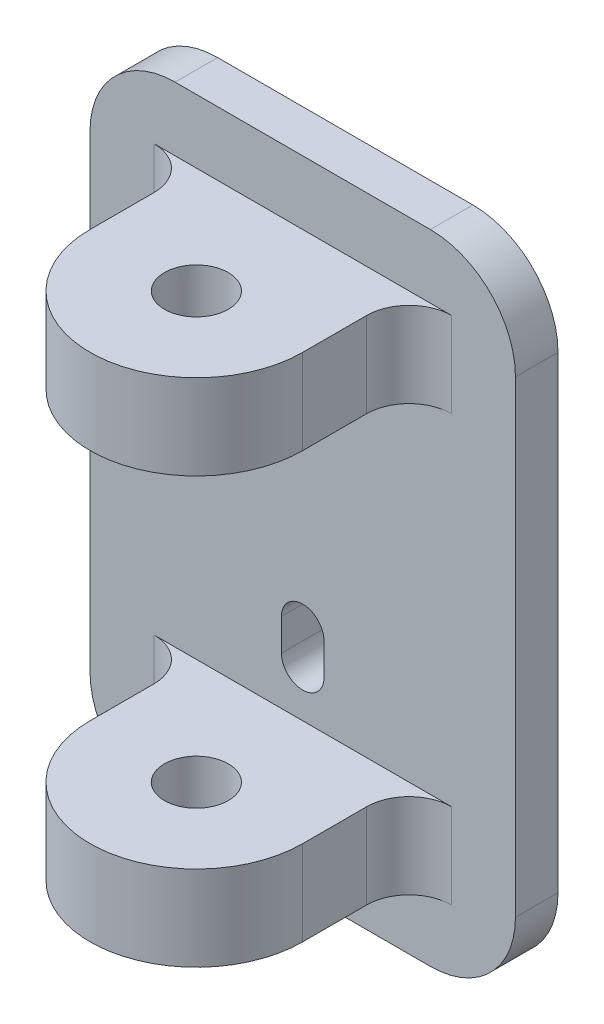
from build123d import *

# Parameters (mm, degrees)
BOSS_EXTRUDE1_DEPTH = 2.54
SKETCH2_W           = 12.7
SKETCH2_H           = 5.08
BOSS_EXTRUDE2_DEPTH = 12.7
CUT_EXTRUDE2_DEPTH  = 101.731669178
SKETCH4_R           = 1.905
CUT_EXTRUDE3_DEPTH  = 101.731669178
SKETCH5_R           = 1.27
CUT_EXTRUDE4_DEPTH  = 105.216075999
FILLET2_R           = 2.54


with BuildPart() as part:
    # Sketch1 → Boss-Extrude1 (new body)
    with BuildSketch(Plane.XY):
        with BuildLine():
            Line((73.161588965, -6.18197174), (88.401588965, -6.18197174))
            ThreePointArc((88.401588965, -6.18197174), (91.993691413, -7.669869292), (93.481588965, -11.26197174))
            Line((93.481588965, -11.26197174), (93.481588965, -39.20197174))
            ThreePointArc((93.481588965, -39.20197174), (91.993691413, -42.794074189), (88.401588965, -44.28197174))
            Line((88.401588965, -44.28197174), (73.161588965, -44.28197174))
            ThreePointArc((73.161588965, -44.28197174), (69.569486517, -42.794074189), (68.081588965, -39.20197174))
            Line((68.081588965, -39.20197174), (68.081588965, -11.26197174))
            ThreePointArc((68.081588965, -11.26197174), (69.569486517, -7.669869292), (73.161588965, -6.18197174))
        make_face()
    extrude(amount=BOSS_EXTRUDE1_DEPTH)

    # Sketch2 → Boss-Extrude2 (add)
    with BuildSketch(Plane.XY.offset(2.54)):
        with Locations((80.781588965, -12.53197174)):
            Rectangle(SKETCH2_W, SKETCH2_H)
        with Locations((80.781588965, -37.93197174)):
            Rectangle(SKETCH2_W, SKETCH2_H)
    extrude(amount=BOSS_EXTRUDE2_DEPTH)

    # Sketch3 → Cut-Extrude2 (cut, through all)
    with BuildSketch(Plane(origin=(0, -40.47197174, 0), x_dir=(-1, 0, 0), z_dir=(0, -1, 0))):
        with BuildLine():
            Line((-87.131588965, -15.24), (-80.781588965, -15.24))
            ThreePointArc((-80.781588965, -15.24), (-85.271717026, -13.380128061), (-87.131588965, -8.89))
            Line((-87.131588965, -8.89), (-87.131588965, -15.24))
        make_face()
        with BuildLine():
            Line((-74.431588965, -15.24), (-74.431588965, -8.89))
            ThreePointArc((-74.431588965, -8.89), (-76.291460904, -13.380128061), (-80.781588965, -15.24))
            Line((-80.781588965, -15.24), (-74.431588965, -15.24))
        make_face()
    extrude(amount=-CUT_EXTRUDE2_DEPTH, mode=Mode.SUBTRACT)

    # Sketch4 → Cut-Extrude3 (cut, through all)
    with BuildSketch(Plane.XZ.offset(40.47197174)):
        with Locations((80.781588965, 8.89)):
            Circle(SKETCH4_R)
    extrude(amount=-CUT_EXTRUDE3_DEPTH, mode=Mode.SUBTRACT)

    # Sketch5 → Cut-Extrude4 (cut, through all)
    with BuildSketch(Plane.XY.offset(2.54)):
        with Locations((80.781588965, -18.88197174)):
            Circle(SKETCH5_R)
        with BuildLine():
            Line((79.511588965, -32.53447174), (79.511588965, -30.62947174))
            ThreePointArc((79.511588965, -30.62947174), (80.781588965, -29.35947174), (82.051588965, -30.62947174))
            Line((82.051588965, -30.62947174), (82.051588965, -32.53447174))
            ThreePointArc((82.051588965, -32.53447174), (80.781588965, -33.80447174), (79.511588965, -32.53447174))
        make_face()
    extrude(amount=-CUT_EXTRUDE4_DEPTH, mode=Mode.SUBTRACT)

    # Fillet2
    fillet2_edges = [part.edges().sort_by_distance(p)[0] for p in [
        (87.131588965, -12.53197174, 2.54),
        (87.131588965, -37.93197174, 2.54),
        (74.431588965, -37.93197174, 2.54),
        (74.431588965, -12.53197174, 2.54),
    ]]
    fillet(fillet2_edges, radius=FILLET2_R)


solid = part.part
